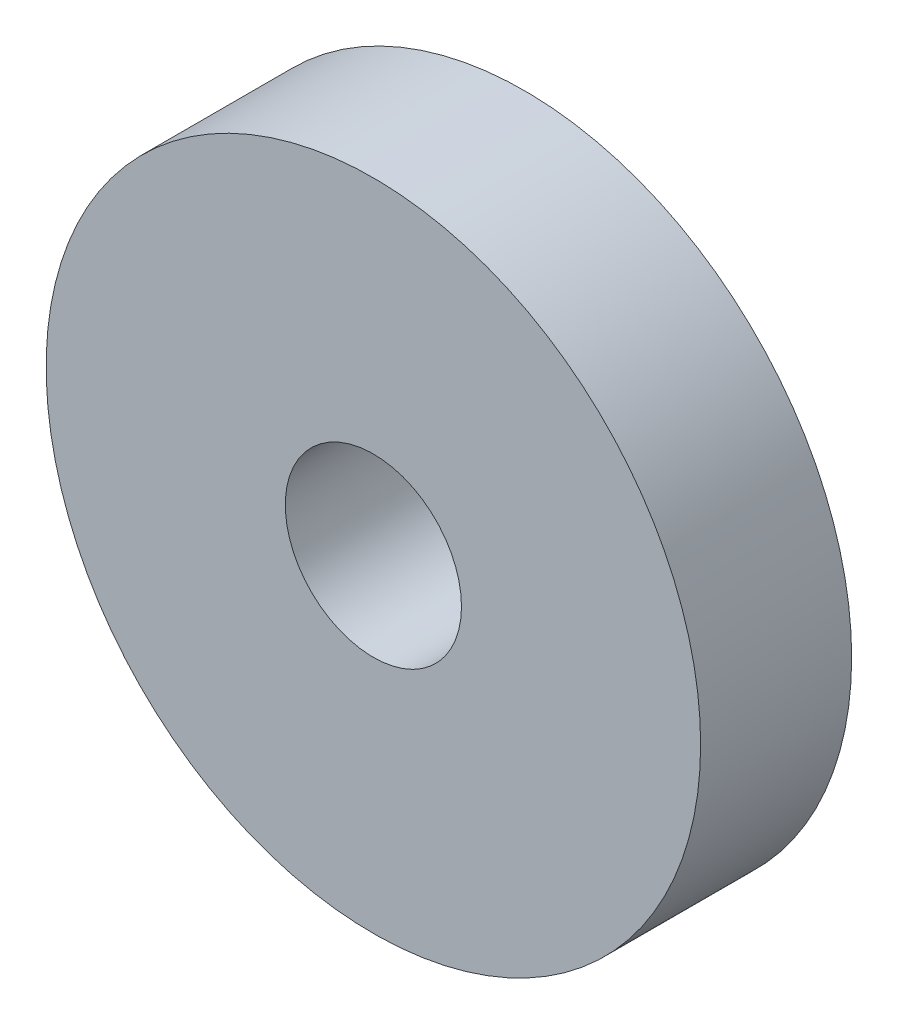
from build123d import *

# Parameters (mm, degrees)
SKETCH1_R           = 6.5
SKETCH1_R_2         = 1.75
BOSS_EXTRUDE1_DEPTH = 3


with BuildPart() as part:
    # Sketch1 → Boss-Extrude1 (new body)
    with BuildSketch(Plane.XY):
        with Locations((-9.5, 0)):
            Circle(SKETCH1_R)
        with Locations((-9.5, 0)):
            Circle(SKETCH1_R_2, mode=Mode.SUBTRACT)
    extrude(amount=BOSS_EXTRUDE1_DEPTH)


solid = part.part
